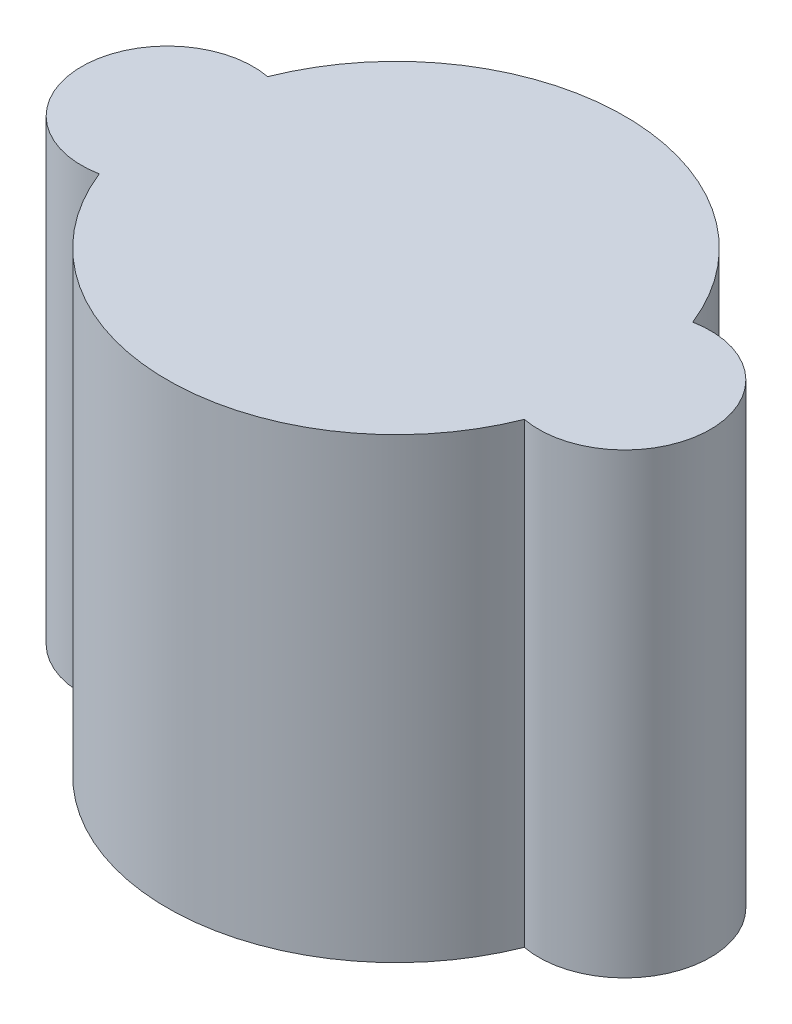
from build123d import *

# Parameters (mm, degrees)
SKETCH2_R           = 3
SKETCH2_R_2         = 8
BOSS_EXTRUDE1_DEPTH = 16


with BuildPart() as part:
    # Sketch2 → Boss-Extrude1 (new body)
    with BuildSketch(Plane(origin=(0, 0, 0), x_dir=(1, 0, 0), z_dir=(0, 1, 0))):
        with Locations((-8, 0)):
            Circle(SKETCH2_R)
        Circle(SKETCH2_R_2)
        with Locations((8, 0)):
            Circle(SKETCH2_R)
    extrude(amount=BOSS_EXTRUDE1_DEPTH)


solid = part.part
